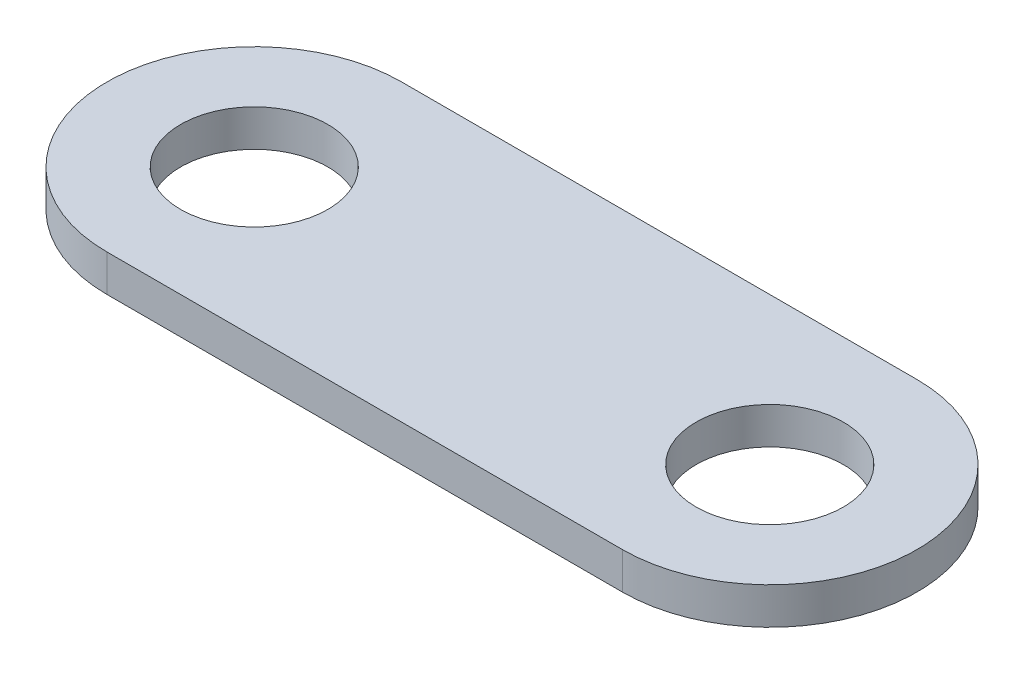
from build123d import *

# Parameters (mm, degrees)
SKETCH1_R           = 6.35
BOSS_EXTRUDE1_DEPTH = 3.175


with BuildPart() as part:
    # Sketch1 → Boss-Extrude1 (new body)
    with BuildSketch(Plane(origin=(0, 0, 0), x_dir=(1, 0, 0), z_dir=(0, 1, 0))):
        with BuildLine():
            Line((0, 12.7), (44.45, 12.7))
            ThreePointArc((44.45, 12.7), (57.15, 0), (44.45, -12.7))
            Line((44.45, -12.7), (0, -12.7))
            ThreePointArc((0, -12.7), (-12.7, 0), (0, 12.7))
        make_face()
        with Locations(Location((0, 0, 0), (0, 0, 270))):
            Circle(SKETCH1_R, mode=Mode.SUBTRACT)
        with Locations(Location((44.45, 0, 0), (0, 0, 270))):
            Circle(SKETCH1_R, mode=Mode.SUBTRACT)
    extrude(amount=BOSS_EXTRUDE1_DEPTH)


solid = part.part
